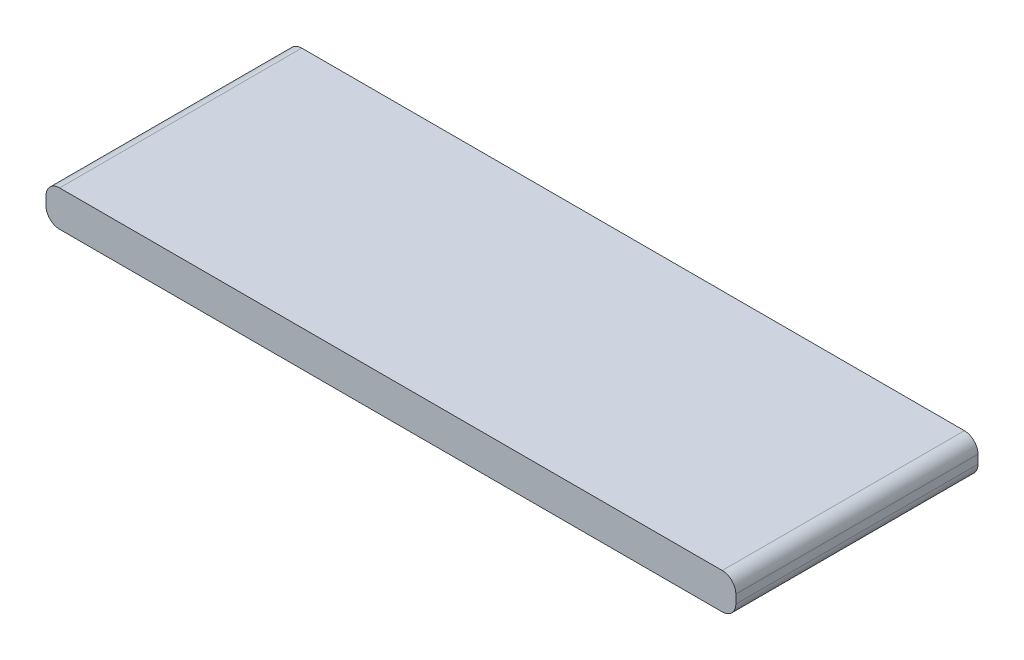
from build123d import *

# Parameters (mm, degrees)
SKETCH2_W           = 152.4
SKETCH2_H           = 7.924066875
BOSS_EXTRUDE1_DEPTH = 53.499999934
FILLET1_R           = 3


with BuildPart() as part:
    # Sketch2 → Boss-Extrude1 (new body)
    with BuildSketch(Plane.XY):
        with Locations((76.2, 3.962033438)):
            Rectangle(SKETCH2_W, SKETCH2_H)
    extrude(amount=BOSS_EXTRUDE1_DEPTH)

    # Fillet1
    fillet1_edges = [part.edges().sort_by_distance(p)[0] for p in [
        (0, 0, 26.749999967),
        (0, 7.924066875, 26.749999967),
        (152.4, 7.924066875, 26.749999967),
        (152.4, 0, 26.749999967),
    ]]
    fillet(fillet1_edges, radius=FILLET1_R)


solid = part.part
